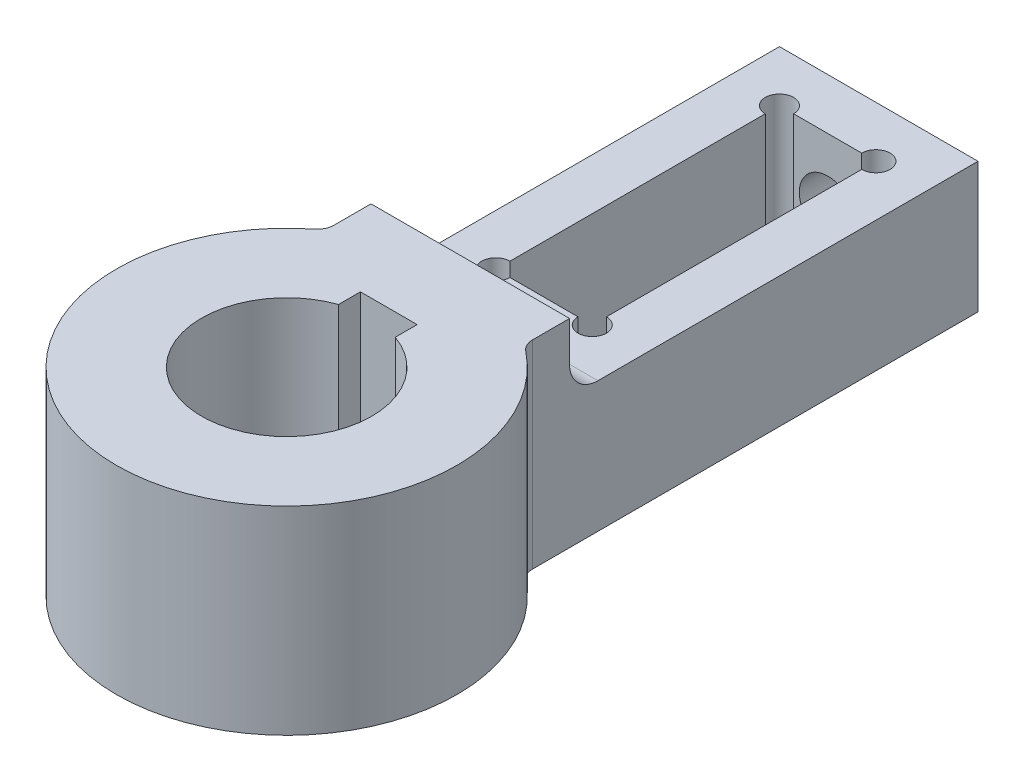
from build123d import *

# Parameters (mm, degrees)
BOSS_EXTRUDE1_DEPTH = 35
SKETCH2_W           = 35
SKETCH2_H           = 12
CUT_EXTRUDE1_DEPTH  = 72
FILLET1_R           = 5
FILLET2_R           = 3
SKETCH3_R           = 5
CUT_EXTRUDE2_DEPTH  = 65


with BuildPart() as part:
    # Sketch1 → Boss-Extrude1 (new body)
    with BuildSketch(Plane(origin=(0, 0, 0), x_dir=(1, 0, 0), z_dir=(0, 1, 0))):
        with BuildLine():
            Line((-17.5, 104.366985862), (17.5, 104.366985862))
            Line((17.5, 104.366985862), (17.5, 24.366985862))
            ThreePointArc((17.5, 24.366985862), (0, -30), (-17.5, 24.366985862))
            Line((-17.5, 24.366985862), (-17.5, 104.366985862))
        make_face()
        with BuildLine():
            Line((-6, 95.366985862), (6, 95.366985862))
            ThreePointArc((6, 95.366985862), (10.267766953, 97.134752815), (8.5, 92.866985862))
            Line((8.5, 92.866985862), (8.5, 47.866985862))
            ThreePointArc((8.5, 47.866985862), (10.267766953, 43.599218909), (6, 45.366985862))
            Line((6, 45.366985862), (-6, 45.366985862))
            ThreePointArc((-6, 45.366985862), (-10.267766953, 43.599218909), (-8.5, 47.866985862))
            Line((-8.5, 47.866985862), (-8.5, 92.866985862))
            ThreePointArc((-8.5, 92.866985862), (-10.267766953, 97.134752815), (-6, 95.366985862))
        make_face(mode=Mode.SUBTRACT)
        with BuildLine():
            Line((5, 18), (5, 14.142135624))
            ThreePointArc((5, 14.142135624), (0, -15), (-5, 14.142135624))
            Line((-5, 14.142135624), (-5, 18))
            Line((-5, 18), (5, 18))
        make_face(mode=Mode.SUBTRACT)
    extrude(amount=BOSS_EXTRUDE1_DEPTH)

    # Sketch2 → Cut-Extrude1 (cut)
    with BuildSketch(Plane(origin=(0, 0, -104.366985862), x_dir=(-1, 0, 0), z_dir=(0, 0, -1))):
        with Locations((0, 29)):
            Rectangle(SKETCH2_W, SKETCH2_H)
    extrude(amount=-CUT_EXTRUDE1_DEPTH, mode=Mode.SUBTRACT)

    # Fillet1
    fillet1_edges = [part.edges().sort_by_distance(p)[0] for p in [
        (0, 23, -32.366985862),
    ]]
    fillet(fillet1_edges, radius=FILLET1_R)

    # Fillet2
    fillet2_edges = [part.edges().sort_by_distance(p)[0] for p in [
        (-17.5, 17.5, -24.366985862),
        (17.5, 17.5, -24.366985862),
    ]]
    fillet(fillet2_edges, radius=FILLET2_R)

    # Sketch3 → Cut-Extrude2 (cut)
    with BuildSketch(Plane(origin=(0, 0, -104.366985862), x_dir=(-1, 0, 0), z_dir=(0, 0, -1))):
        with Locations((0, 11.5)):
            Circle(SKETCH3_R)
    extrude(amount=-CUT_EXTRUDE2_DEPTH, mode=Mode.SUBTRACT)


solid = part.part
